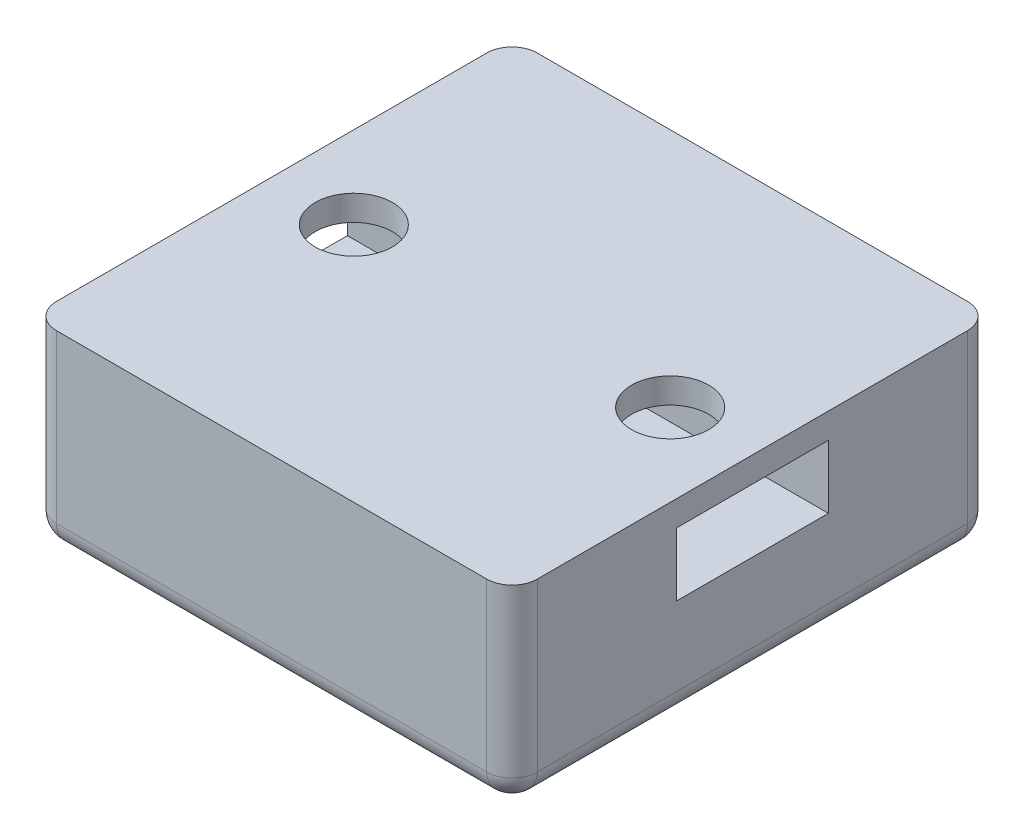
from build123d import *

# Parameters (mm, degrees)
SKETCH1_W           = 19
SKETCH1_H           = 19
BOSS_EXTRUDE1_DEPTH = 7.6
CUT_EXTRUDE1_REACH  = 29.924
SKETCH2_W           = 6
SKETCH2_H           = 2.5
CUT_EXTRUDE2_REACH  = 29.924
SKETCH3_R           = 1.525
SKETCH4_R           = 5.05
CUT_EXTRUDE3_DEPTH  = 3.1
FILLET1_R           = 1
FILLET2_R           = 1
CUT_EXTRUDE4_REACH  = 29.244
SKETCH5_R           = 1.55


with BuildPart() as part:
    # Sketch1 → Boss-Extrude1 (new body)
    with BuildSketch(Plane(origin=(0, 0, 0), x_dir=(1, 0, 0), z_dir=(0, 1, 0))):
        with Locations((9.5, 9.5)):
            Rectangle(SKETCH1_W, SKETCH1_H)
    extrude(amount=BOSS_EXTRUDE1_DEPTH)

    # Sketch2 → Cut-Extrude1 (cut, up to next)
    with BuildSketch(Plane(origin=(19, 0, 0), x_dir=(0, 0, -1), z_dir=(1, 0, 0)), mode=Mode.PRIVATE) as cut_extrude1_sk1:
        with Locations((9.5, 5.35)):
            Rectangle(SKETCH2_W, SKETCH2_H)
    cut_extrude1_tool1 = extrude(cut_extrude1_sk1.sketch, amount=-CUT_EXTRUDE1_REACH, mode=Mode.PRIVATE) & part.part
    add(cut_extrude1_tool1.solids().sort_by_distance((19, 5.35, -9.5))[0], mode=Mode.SUBTRACT)

    # Sketch3 → Cut-Extrude2 (cut, up to next)
    with BuildSketch(Plane(origin=(0, 7.6, 0), x_dir=(1, 0, 0), z_dir=(0, 1, 0)), mode=Mode.PRIVATE) as cut_extrude2_sk1:
        with Locations(Location((3.25, 9.5, 0), (0, 0, 270))):
            Circle(SKETCH3_R)
    cut_extrude2_tool1 = extrude(cut_extrude2_sk1.sketch, amount=-CUT_EXTRUDE2_REACH, mode=Mode.PRIVATE) & part.part
    # Sketch3 → Cut-Extrude2 (cut, up to next)
    with BuildSketch(Plane(origin=(0, 7.6, 0), x_dir=(1, 0, 0), z_dir=(0, 1, 0)), mode=Mode.PRIVATE) as cut_extrude2_sk2:
        with Locations(Location((15.75, 9.5, 0), (0, 0, 270))):
            Circle(SKETCH3_R)
    cut_extrude2_tool2 = extrude(cut_extrude2_sk2.sketch, amount=-CUT_EXTRUDE2_REACH, mode=Mode.PRIVATE) & part.part
    add(cut_extrude2_tool1.solids().sort_by_distance((3.25, 7.6, -9.5))[0], mode=Mode.SUBTRACT)
    add(cut_extrude2_tool2.solids().sort_by_distance((15.75, 7.6, -9.5))[0], mode=Mode.SUBTRACT)

    # Sketch4 → Cut-Extrude3 (cut)
    with BuildSketch(Plane.XZ):
        with Locations(Location((9.5, -9.5, 0), (0, 0, 270))):
            Circle(SKETCH4_R)
    extrude(amount=-CUT_EXTRUDE3_DEPTH, mode=Mode.SUBTRACT)

    # Fillet1
    fillet1_edges = [part.edges().sort_by_distance(p)[0] for p in [
        (0, 3.8, -19),
        (19, 3.8, -19),
        (19, 3.8, 0),
        (0, 3.8, 0),
    ]]
    fillet(fillet1_edges, radius=FILLET1_R)

    # Fillet2
    fillet2_edges = [part.edges().sort_by_distance(p)[0] for p in [
        (9.5, 0, -4.45),
        (0, 0, -9.5),
        (9.5, 0, -19),
        (19, 0, -9.5),
        (9.5, 0, 0),
        (18.707106781, 0, -0.292893219),
        (0.292893219, 0, -0.292893219),
        (18.707106781, 0, -18.707106781),
        (0.292893219, 0, -18.707106781),
    ]]
    fillet(fillet2_edges, radius=FILLET2_R)

    # Sketch5 → Cut-Extrude4 (cut, up to next)
    with BuildSketch(Plane.XZ.offset(-3.1), mode=Mode.PRIVATE) as cut_extrude4_sk1:
        with Locations(Location((9.5, -9.5, 0), (0, 0, 270))):
            Circle(SKETCH5_R)
    cut_extrude4_tool1 = extrude(cut_extrude4_sk1.sketch, amount=-CUT_EXTRUDE4_REACH, mode=Mode.PRIVATE) & part.part
    add(cut_extrude4_tool1.solids().sort_by_distance((9.5, 3.1, -9.5))[0], mode=Mode.SUBTRACT)


solid = part.part
